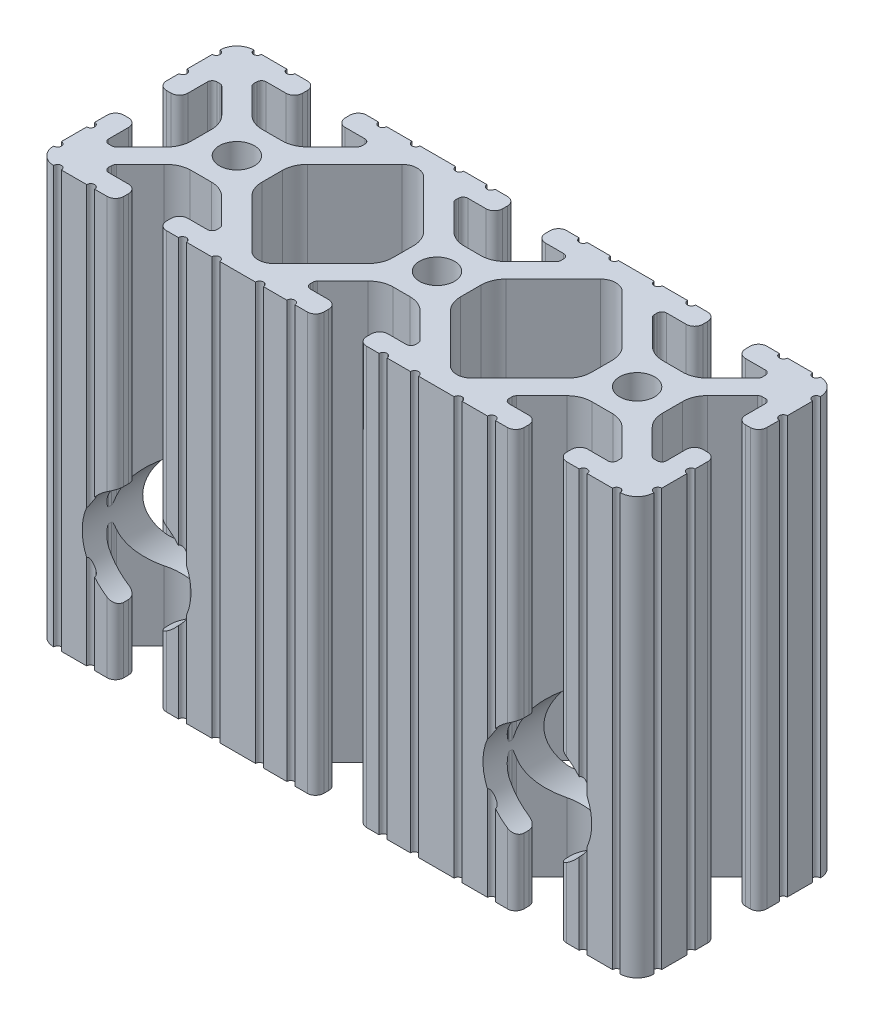
from build123d import *

# Parameters (mm, degrees)
SKETCH14_R                = 3.3274
F_15_1545_PROFILE_1_DEPTH = 79.375
SKETCH15_R                = 10.3505
CUT_EXTRUDE1_DEPTH        = 15.748


with BuildPart() as part:
    # Sketch14 → 15 1545 PROFILE(1) (new body)
    with BuildSketch(Plane.ZX.offset(-39.6875)):
        with BuildLine():
            Line((-14.986, -9.130462054), (-14.986, -5.6388))
            ThreePointArc((-14.986, -5.6388), (-15.447248241, -4.525248241), (-16.5608, -4.064))
            Line((-16.5608, -4.064), (-17.4752, -4.064))
            ThreePointArc((-17.4752, -4.064), (-18.588751759, -4.525248241), (-19.05, -5.6388))
            Line((-19.05, -5.6388), (-19.05, -8.023791585))
            ThreePointArc((-19.05, -8.023791585), (-18.288, -8.785791585), (-19.05, -9.547791585))
            Line((-19.05, -9.547791585), (-19.05, -13.984497194))
            ThreePointArc((-19.05, -13.984497194), (-18.288000009, -14.746497184), (-19.05, -15.508497175))
            Line((-19.05, -15.508497175), (-19.05, -22.30100558))
            ThreePointArc((-19.05, -22.30100558), (-18.288, -23.06300558), (-19.05, -23.82500558))
            Line((-19.05, -23.82500558), (-19.05, -28.653420271))
            ThreePointArc((-19.05, -28.653420271), (-18.288, -29.415420271), (-19.05, -30.177420271))
            Line((-19.05, -30.177420271), (-19.05, -32.4612))
            ThreePointArc((-19.05, -32.4612), (-18.588751759, -33.574751759), (-17.4752, -34.036))
            Line((-17.4752, -34.036), (-16.5608, -34.036))
            ThreePointArc((-16.5608, -34.036), (-15.447248241, -33.574751759), (-14.986, -32.4612))
            Line((-14.986, -32.4612), (-14.986, -28.7208616))
            ThreePointArc((-14.986, -28.7208616), (-14.725617928, -28.092243671), (-14.097, -27.8318616))
            Line((-14.097, -27.8318616), (-13.547779415, -27.8318616))
            ThreePointArc((-13.547779415, -27.8318616), (-13.207573844, -27.899532695), (-12.919161487, -28.092243671))
            Line((-12.919161487, -28.092243671), (-8.147584211, -32.863820948))
            ThreePointArc((-8.147584211, -32.863820948), (-7.117956996, -34.40476697), (-6.7564, -36.222436737))
            Line((-6.7564, -36.222436737), (-6.7564, -40.243886463))
            ThreePointArc((-6.7564, -40.243886463), (-7.222930328, -42.088789954), (-8.376184211, -43.602502252))
            Line((-8.376184211, -43.602502252), (-12.919161487, -48.145479528))
            ThreePointArc((-12.919161487, -48.145479528), (-13.207573844, -48.338190504), (-13.547779415, -48.4058616))
            Line((-13.547779415, -48.4058616), (-14.097, -48.4058616))
            ThreePointArc((-14.097, -48.4058616), (-14.725617928, -48.145479528), (-14.986, -47.5168616))
            Line((-14.986, -47.5168616), (-14.986, -43.7388))
            ThreePointArc((-14.986, -43.7388), (-15.447248241, -42.625248241), (-16.5608, -42.164))
            Line((-16.5608, -42.164), (-17.4752, -42.164))
            ThreePointArc((-17.4752, -42.164), (-18.588751759, -42.625248241), (-19.05, -43.7388))
            Line((-19.05, -43.7388), (-19.05, -46.125701672))
            ThreePointArc((-19.05, -46.125701672), (-18.288, -46.887701672), (-19.05, -47.649701672))
            Line((-19.05, -47.649701672), (-19.05, -52.476140467))
            ThreePointArc((-19.05, -52.476140467), (-18.2879999, -53.201256979), (-19.049898195, -53.92648046))
            ThreePointArc((-19.049898195, -53.92648046), (-18.099426561, -56.199426561), (-15.82648046, -57.149898195))
            ThreePointArc((-15.82648046, -57.149898195), (-15.101256979, -56.3879999), (-14.376140467, -57.15))
            Line((-14.376140467, -57.15), (-9.549701672, -57.15))
            ThreePointArc((-9.549701672, -57.15), (-8.787701672, -56.388), (-8.025701672, -57.15))
            Line((-8.025701672, -57.15), (-5.6388, -57.15))
            ThreePointArc((-5.6388, -57.15), (-4.525248241, -56.688751759), (-4.064, -55.5752))
            Line((-4.064, -55.5752), (-4.064, -54.6608))
            ThreePointArc((-4.064, -54.6608), (-4.525248241, -53.547248241), (-5.6388, -53.086))
            Line((-5.6388, -53.086), (-9.4168616, -53.086))
            ThreePointArc((-9.4168616, -53.086), (-10.032142363, -52.831142363), (-10.287, -52.2158616))
            Line((-10.287, -52.2158616), (-10.287, -51.628917816))
            ThreePointArc((-10.287, -51.628917816), (-10.219328904, -51.288712244), (-10.026617928, -51.000299887))
            Line((-10.026617928, -51.000299887), (-5.273902252, -46.247584211))
            ThreePointArc((-5.273902252, -46.247584211), (-3.73295623, -45.217956996), (-1.915286463, -44.8564))
            Line((-1.915286463, -44.8564), (1.915286463, -44.8564))
            ThreePointArc((1.915286463, -44.8564), (3.73295623, -45.217956996), (5.273902252, -46.247584211))
            Line((5.273902252, -46.247584211), (10.026617928, -51.000299887))
            ThreePointArc((10.026617928, -51.000299887), (10.219328904, -51.288712244), (10.287, -51.628917816))
            Line((10.287, -51.628917816), (10.287, -52.2158616))
            ThreePointArc((10.287, -52.2158616), (10.032142363, -52.831142363), (9.4168616, -53.086))
            Line((9.4168616, -53.086), (5.6388, -53.086))
            ThreePointArc((5.6388, -53.086), (4.525248241, -53.547248241), (4.064, -54.6608))
            Line((4.064, -54.6608), (4.064, -55.5752))
            ThreePointArc((4.064, -55.5752), (4.525248241, -56.688751759), (5.6388, -57.15))
            Line((5.6388, -57.15), (8.025701672, -57.15))
            ThreePointArc((8.025701672, -57.15), (8.787701672, -56.388), (9.549701672, -57.15))
            Line((9.549701672, -57.15), (14.376140467, -57.15))
            ThreePointArc((14.376140467, -57.15), (15.101256979, -56.3879999), (15.82648046, -57.149898195))
            ThreePointArc((15.82648046, -57.149898195), (18.099426561, -56.199426561), (19.049898195, -53.92648046))
            ThreePointArc((19.049898195, -53.92648046), (18.2879999, -53.201256979), (19.05, -52.476140467))
            Line((19.05, -52.476140467), (19.05, -47.649701672))
            ThreePointArc((19.05, -47.649701672), (18.288, -46.887701672), (19.05, -46.125701672))
            Line((19.05, -46.125701672), (19.05, -43.7388))
            ThreePointArc((19.05, -43.7388), (18.588751759, -42.625248241), (17.4752, -42.164))
            Line((17.4752, -42.164), (16.5608, -42.164))
            ThreePointArc((16.5608, -42.164), (15.447248241, -42.625248241), (14.986, -43.7388))
            Line((14.986, -43.7388), (14.986, -47.5168616))
            ThreePointArc((14.986, -47.5168616), (14.725617928, -48.145479528), (14.097, -48.4058616))
            Line((14.097, -48.4058616), (13.547779415, -48.4058616))
            ThreePointArc((13.547779415, -48.4058616), (13.207573844, -48.338190504), (12.919161487, -48.145479528))
            Line((12.919161487, -48.145479528), (8.376184211, -43.602502252))
            ThreePointArc((8.376184211, -43.602502252), (7.222930328, -42.088789954), (6.7564, -40.243886463))
            Line((6.7564, -40.243886463), (6.7564, -36.222436737))
            ThreePointArc((6.7564, -36.222436737), (7.117956996, -34.40476697), (8.147584211, -32.863820948))
            Line((8.147584211, -32.863820948), (12.919161487, -28.092243671))
            ThreePointArc((12.919161487, -28.092243671), (13.207573844, -27.899532695), (13.547779415, -27.8318616))
            Line((13.547779415, -27.8318616), (14.097, -27.8318616))
            ThreePointArc((14.097, -27.8318616), (14.725617928, -28.092243671), (14.986, -28.7208616))
            Line((14.986, -28.7208616), (14.986, -32.4612))
            ThreePointArc((14.986, -32.4612), (15.447248241, -33.574751759), (16.5608, -34.036))
            Line((16.5608, -34.036), (17.4752, -34.036))
            ThreePointArc((17.4752, -34.036), (18.588751759, -33.574751759), (19.05, -32.4612))
            Line((19.05, -32.4612), (19.05, -30.177420271))
            ThreePointArc((19.05, -30.177420271), (18.288, -29.415420271), (19.05, -28.653420271))
            Line((19.05, -28.653420271), (19.05, -23.82500558))
            ThreePointArc((19.05, -23.82500558), (18.288, -23.06300558), (19.05, -22.30100558))
            Line((19.05, -22.30100558), (19.05, -15.508497175))
            ThreePointArc((19.05, -15.508497175), (18.288000009, -14.746497184), (19.05, -13.984497194))
            Line((19.05, -13.984497194), (19.05, -9.547791585))
            ThreePointArc((19.05, -9.547791585), (18.288, -8.785791585), (19.05, -8.023791585))
            Line((19.05, -8.023791585), (19.05, -5.6388))
            ThreePointArc((19.05, -5.6388), (18.588751759, -4.525248241), (17.4752, -4.064))
            Line((17.4752, -4.064), (16.5608, -4.064))
            ThreePointArc((16.5608, -4.064), (15.447248241, -4.525248241), (14.986, -5.6388))
            Line((14.986, -5.6388), (14.986, -9.130462054))
            ThreePointArc((14.986, -9.130462054), (14.725617928, -9.759079983), (14.097, -10.019462054))
            Line((14.097, -10.019462054), (13.589600315, -10.019462054))
            ThreePointArc((13.589600315, -10.019462054), (13.249394744, -9.951790959), (12.960982387, -9.759079983))
            Line((12.960982387, -9.759079983), (8.147584211, -4.945681807))
            ThreePointArc((8.147584211, -4.945681807), (7.117956996, -3.404735785), (6.7564, -1.587066018))
            Line((6.7564, -1.587066018), (6.7564, 1.587066018))
            ThreePointArc((6.7564, 1.587066018), (7.117956996, 3.404735785), (8.147584211, 4.945681807))
            Line((8.147584211, 4.945681807), (12.960982387, 9.759079983))
            ThreePointArc((12.960982387, 9.759079983), (13.249394744, 9.951790959), (13.589600315, 10.019462054))
            Line((13.589600315, 10.019462054), (14.097, 10.019462054))
            ThreePointArc((14.097, 10.019462054), (14.725617928, 9.759079983), (14.986, 9.130462054))
            Line((14.986, 9.130462054), (14.986, 5.6388))
            ThreePointArc((14.986, 5.6388), (15.447248241, 4.525248241), (16.5608, 4.064))
            Line((16.5608, 4.064), (17.4752, 4.064))
            ThreePointArc((17.4752, 4.064), (18.588751759, 4.525248241), (19.05, 5.6388))
            Line((19.05, 5.6388), (19.05, 8.023791585))
            ThreePointArc((19.05, 8.023791585), (18.288, 8.785791585), (19.05, 9.547791585))
            Line((19.05, 9.547791585), (19.05, 13.984497194))
            ThreePointArc((19.05, 13.984497194), (18.288000009, 14.746497184), (19.05, 15.508497175))
            Line((19.05, 15.508497175), (19.05, 22.30100558))
            ThreePointArc((19.05, 22.30100558), (18.288, 23.06300558), (19.05, 23.82500558))
            Line((19.05, 23.82500558), (19.05, 28.653420271))
            ThreePointArc((19.05, 28.653420271), (18.288, 29.415420271), (19.05, 30.177420271))
            Line((19.05, 30.177420271), (19.05, 32.4612))
            ThreePointArc((19.05, 32.4612), (18.588751759, 33.574751759), (17.4752, 34.036))
            Line((17.4752, 34.036), (16.5608, 34.036))
            ThreePointArc((16.5608, 34.036), (15.447248241, 33.574751759), (14.986, 32.4612))
            Line((14.986, 32.4612), (14.986, 28.7208616))
            ThreePointArc((14.986, 28.7208616), (14.725617928, 28.092243671), (14.097, 27.8318616))
            Line((14.097, 27.8318616), (13.547779415, 27.8318616))
            ThreePointArc((13.547779415, 27.8318616), (13.207573844, 27.899532695), (12.919161487, 28.092243671))
            Line((12.919161487, 28.092243671), (8.147584211, 32.863820948))
            ThreePointArc((8.147584211, 32.863820948), (7.117956996, 34.40476697), (6.7564, 36.222436737))
            Line((6.7564, 36.222436737), (6.7564, 40.243886463))
            ThreePointArc((6.7564, 40.243886463), (7.222930328, 42.088789954), (8.376184211, 43.602502252))
            Line((8.376184211, 43.602502252), (12.919161487, 48.145479528))
            ThreePointArc((12.919161487, 48.145479528), (13.207573844, 48.338190504), (13.547779415, 48.4058616))
            Line((13.547779415, 48.4058616), (14.097, 48.4058616))
            ThreePointArc((14.097, 48.4058616), (14.725617928, 48.145479528), (14.986, 47.5168616))
            Line((14.986, 47.5168616), (14.986, 43.7388))
            ThreePointArc((14.986, 43.7388), (15.447248241, 42.625248241), (16.5608, 42.164))
            Line((16.5608, 42.164), (17.4752, 42.164))
            ThreePointArc((17.4752, 42.164), (18.588751759, 42.625248241), (19.05, 43.7388))
            Line((19.05, 43.7388), (19.05, 46.125701672))
            ThreePointArc((19.05, 46.125701672), (18.288, 46.887701672), (19.05, 47.649701672))
            Line((19.05, 47.649701672), (19.05, 52.476140467))
            ThreePointArc((19.05, 52.476140467), (18.2879999, 53.201256979), (19.049898195, 53.92648046))
            ThreePointArc((19.049898195, 53.92648046), (18.099426561, 56.199426561), (15.82648046, 57.149898195))
            ThreePointArc((15.82648046, 57.149898195), (15.101256979, 56.3879999), (14.376140467, 57.15))
            Line((14.376140467, 57.15), (9.549701672, 57.15))
            ThreePointArc((9.549701672, 57.15), (8.787701672, 56.388), (8.025701672, 57.15))
            Line((8.025701672, 57.15), (5.6388, 57.15))
            ThreePointArc((5.6388, 57.15), (4.525248241, 56.688751759), (4.064, 55.5752))
            Line((4.064, 55.5752), (4.064, 54.6608))
            ThreePointArc((4.064, 54.6608), (4.525248241, 53.547248241), (5.6388, 53.086))
            Line((5.6388, 53.086), (9.4168616, 53.086))
            ThreePointArc((9.4168616, 53.086), (10.032142363, 52.831142363), (10.287, 52.2158616))
            Line((10.287, 52.2158616), (10.287, 51.628917816))
            ThreePointArc((10.287, 51.628917816), (10.219328904, 51.288712244), (10.026617928, 51.000299887))
            Line((10.026617928, 51.000299887), (5.273902252, 46.247584211))
            ThreePointArc((5.273902252, 46.247584211), (3.73295623, 45.217956996), (1.915286463, 44.8564))
            Line((1.915286463, 44.8564), (-1.915286463, 44.8564))
            ThreePointArc((-1.915286463, 44.8564), (-3.73295623, 45.217956996), (-5.273902252, 46.247584211))
            Line((-5.273902252, 46.247584211), (-10.026617928, 51.000299887))
            ThreePointArc((-10.026617928, 51.000299887), (-10.219328904, 51.288712244), (-10.287, 51.628917816))
            Line((-10.287, 51.628917816), (-10.287, 52.2158616))
            ThreePointArc((-10.287, 52.2158616), (-10.032142363, 52.831142363), (-9.4168616, 53.086))
            Line((-9.4168616, 53.086), (-5.6388, 53.086))
            ThreePointArc((-5.6388, 53.086), (-4.525248241, 53.547248241), (-4.064, 54.6608))
            Line((-4.064, 54.6608), (-4.064, 55.5752))
            ThreePointArc((-4.064, 55.5752), (-4.525248241, 56.688751759), (-5.6388, 57.15))
            Line((-5.6388, 57.15), (-8.025701672, 57.15))
            ThreePointArc((-8.025701672, 57.15), (-8.787701672, 56.388), (-9.549701672, 57.15))
            Line((-9.549701672, 57.15), (-14.376140467, 57.15))
            ThreePointArc((-14.376140467, 57.15), (-15.101256979, 56.3879999), (-15.82648046, 57.149898195))
            ThreePointArc((-15.82648046, 57.149898195), (-18.099426561, 56.199426561), (-19.049898195, 53.92648046))
            ThreePointArc((-19.049898195, 53.92648046), (-18.2879999, 53.201256979), (-19.05, 52.476140467))
            Line((-19.05, 52.476140467), (-19.05, 47.649701672))
            ThreePointArc((-19.05, 47.649701672), (-18.288, 46.887701672), (-19.05, 46.125701672))
            Line((-19.05, 46.125701672), (-19.05, 43.7388))
            ThreePointArc((-19.05, 43.7388), (-18.588751759, 42.625248241), (-17.4752, 42.164))
            Line((-17.4752, 42.164), (-16.5608, 42.164))
            ThreePointArc((-16.5608, 42.164), (-15.447248241, 42.625248241), (-14.986, 43.7388))
            Line((-14.986, 43.7388), (-14.986, 47.5168616))
            ThreePointArc((-14.986, 47.5168616), (-14.725617928, 48.145479528), (-14.097, 48.4058616))
            Line((-14.097, 48.4058616), (-13.547779415, 48.4058616))
            ThreePointArc((-13.547779415, 48.4058616), (-13.207573844, 48.338190504), (-12.919161487, 48.145479528))
            Line((-12.919161487, 48.145479528), (-8.376184211, 43.602502252))
            ThreePointArc((-8.376184211, 43.602502252), (-7.222930328, 42.088789954), (-6.7564, 40.243886463))
            Line((-6.7564, 40.243886463), (-6.7564, 36.222436737))
            ThreePointArc((-6.7564, 36.222436737), (-7.117956996, 34.40476697), (-8.147584211, 32.863820948))
            Line((-8.147584211, 32.863820948), (-12.919161487, 28.092243671))
            ThreePointArc((-12.919161487, 28.092243671), (-13.207573844, 27.899532695), (-13.547779415, 27.8318616))
            Line((-13.547779415, 27.8318616), (-14.097, 27.8318616))
            ThreePointArc((-14.097, 27.8318616), (-14.725617928, 28.092243671), (-14.986, 28.7208616))
            Line((-14.986, 28.7208616), (-14.986, 32.4612))
            ThreePointArc((-14.986, 32.4612), (-15.447248241, 33.574751759), (-16.5608, 34.036))
            Line((-16.5608, 34.036), (-17.4752, 34.036))
            ThreePointArc((-17.4752, 34.036), (-18.588751759, 33.574751759), (-19.05, 32.4612))
            Line((-19.05, 32.4612), (-19.05, 30.177420271))
            ThreePointArc((-19.05, 30.177420271), (-18.288, 29.415420271), (-19.05, 28.653420271))
            Line((-19.05, 28.653420271), (-19.05, 23.82500558))
            ThreePointArc((-19.05, 23.82500558), (-18.288, 23.06300558), (-19.05, 22.30100558))
            Line((-19.05, 22.30100558), (-19.05, 15.508497175))
            ThreePointArc((-19.05, 15.508497175), (-18.288000009, 14.746497184), (-19.05, 13.984497194))
            Line((-19.05, 13.984497194), (-19.05, 9.547791585))
            ThreePointArc((-19.05, 9.547791585), (-18.288, 8.785791585), (-19.05, 8.023791585))
            Line((-19.05, 8.023791585), (-19.05, 5.6388))
            ThreePointArc((-19.05, 5.6388), (-18.588751759, 4.525248241), (-17.4752, 4.064))
            Line((-17.4752, 4.064), (-16.5608, 4.064))
            ThreePointArc((-16.5608, 4.064), (-15.447248241, 4.525248241), (-14.986, 5.6388))
            Line((-14.986, 5.6388), (-14.986, 9.130462054))
            ThreePointArc((-14.986, 9.130462054), (-14.725617928, 9.759079983), (-14.097, 10.019462054))
            Line((-14.097, 10.019462054), (-13.589600315, 10.019462054))
            ThreePointArc((-13.589600315, 10.019462054), (-13.249394744, 9.951790959), (-12.960982387, 9.759079983))
            Line((-12.960982387, 9.759079983), (-8.147584211, 4.945681807))
            ThreePointArc((-8.147584211, 4.945681807), (-7.117956996, 3.404735785), (-6.7564, 1.587066018))
            Line((-6.7564, 1.587066018), (-6.7564, -1.587066018))
            ThreePointArc((-6.7564, -1.587066018), (-7.117956996, -3.404735785), (-8.147584211, -4.945681807))
            Line((-8.147584211, -4.945681807), (-12.960982387, -9.759079983))
            ThreePointArc((-12.960982387, -9.759079983), (-13.249394744, -9.951790959), (-13.589600315, -10.019462054))
            Line((-13.589600315, -10.019462054), (-14.097, -10.019462054))
            ThreePointArc((-14.097, -10.019462054), (-14.725617928, -9.759079983), (-14.986, -9.130462054))
        make_face()
        with Locations((0, 38.1)):
            Circle(SKETCH14_R, mode=Mode.SUBTRACT)
        Circle(SKETCH14_R, mode=Mode.SUBTRACT)
        with Locations((0, -38.1)):
            Circle(SKETCH14_R, mode=Mode.SUBTRACT)
        with BuildLine():
            Line((-14.281465557, 16.82692707), (-5.292763852, 7.838225365))
            ThreePointArc((-5.292763852, 7.838225365), (-3.75181783, 6.808598151), (-1.934148062, 6.447041155))
            Line((-1.934148062, 6.447041155), (1.934148062, 6.447041155))
            ThreePointArc((1.934148062, 6.447041155), (3.75181783, 6.808598151), (5.292763852, 7.838225365))
            Line((5.292763852, 7.838225365), (14.281465557, 16.82692707))
            ThreePointArc((14.281465557, 16.82692707), (15.142128565, 18.904751377), (14.281465557, 20.982575684))
            Line((14.281465557, 20.982575684), (5.292763852, 29.971277389))
            ThreePointArc((5.292763852, 29.971277389), (3.75181783, 31.000904603), (1.934148062, 31.3624616))
            Line((1.934148062, 31.3624616), (-1.934148062, 31.3624616))
            ThreePointArc((-1.934148062, 31.3624616), (-3.75181783, 31.000904603), (-5.292763852, 29.971277389))
            Line((-5.292763852, 29.971277389), (-14.281465557, 20.982575684))
            ThreePointArc((-14.281465557, 20.982575684), (-15.142128565, 18.904751377), (-14.281465557, 16.82692707))
        make_face(mode=Mode.SUBTRACT)
        with BuildLine():
            Line((1.934148062, -6.447041155), (-1.934148062, -6.447041155))
            ThreePointArc((-1.934148062, -6.447041155), (-3.75181783, -6.808598151), (-5.292763852, -7.838225365))
            Line((-5.292763852, -7.838225365), (-14.281465557, -16.82692707))
            ThreePointArc((-14.281465557, -16.82692707), (-15.142128565, -18.904751377), (-14.281465557, -20.982575684))
            Line((-14.281465557, -20.982575684), (-5.292763852, -29.971277389))
            ThreePointArc((-5.292763852, -29.971277389), (-3.75181783, -31.000904603), (-1.934148062, -31.3624616))
            Line((-1.934148062, -31.3624616), (1.934148062, -31.3624616))
            ThreePointArc((1.934148062, -31.3624616), (3.75181783, -31.000904603), (5.292763852, -29.971277389))
            Line((5.292763852, -29.971277389), (14.281465557, -20.982575684))
            ThreePointArc((14.281465557, -20.982575684), (15.142128565, -18.904751377), (14.281465557, -16.82692707))
            Line((14.281465557, -16.82692707), (5.292763852, -7.838225365))
            ThreePointArc((5.292763852, -7.838225365), (3.75181783, -6.808598151), (1.934148062, -6.447041155))
        make_face(mode=Mode.SUBTRACT)
    extrude(amount=F_15_1545_PROFILE_1_DEPTH)

    # Sketch15 → Cut-Extrude1 (cut)
    with BuildSketch(Plane.XY.offset(19.05)):
        with Locations(Location((38.151560971, -17.6875, 0), (0, 0, 352.182281558))):
            Circle(SKETCH15_R)
    cut_extrude1 = extrude(amount=-CUT_EXTRUDE1_DEPTH, mode=Mode.SUBTRACT)

    # Mirror1: Cut-Extrude1 across plane
    add(cut_extrude1.mirror(Plane(origin=(0, 0, 0), x_dir=(0, 0, 1), z_dir=(1, 0, 0))), mode=Mode.SUBTRACT)


solid = part.part
